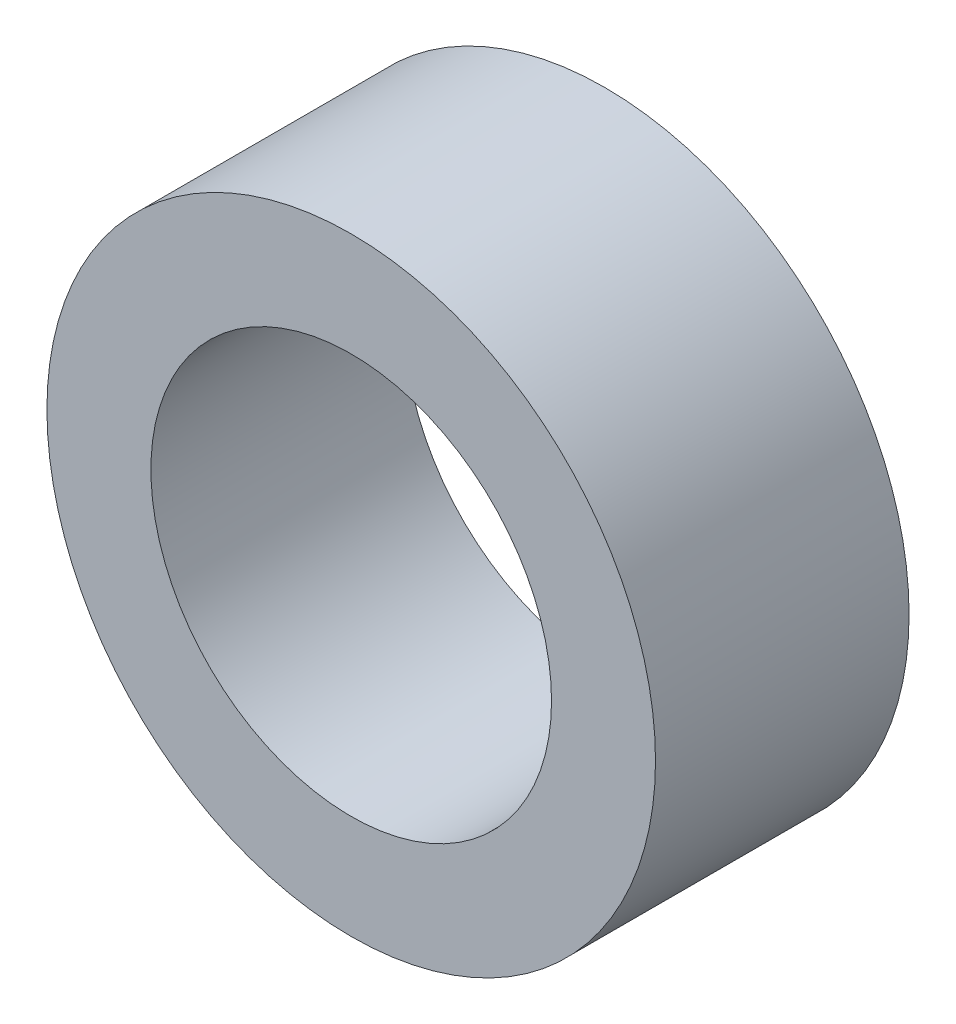
from build123d import *

# Parameters (mm, degrees)
SKETCH1_R           = 6
SKETCH1_R_2         = 3.95
BOSS_EXTRUDE1_DEPTH = 5


with BuildPart() as part:
    # Sketch1 → Boss-Extrude1 (new body)
    with BuildSketch(Plane.XY):
        Circle(SKETCH1_R)
        Circle(SKETCH1_R_2, mode=Mode.SUBTRACT)
    extrude(amount=BOSS_EXTRUDE1_DEPTH)


solid = part.part
